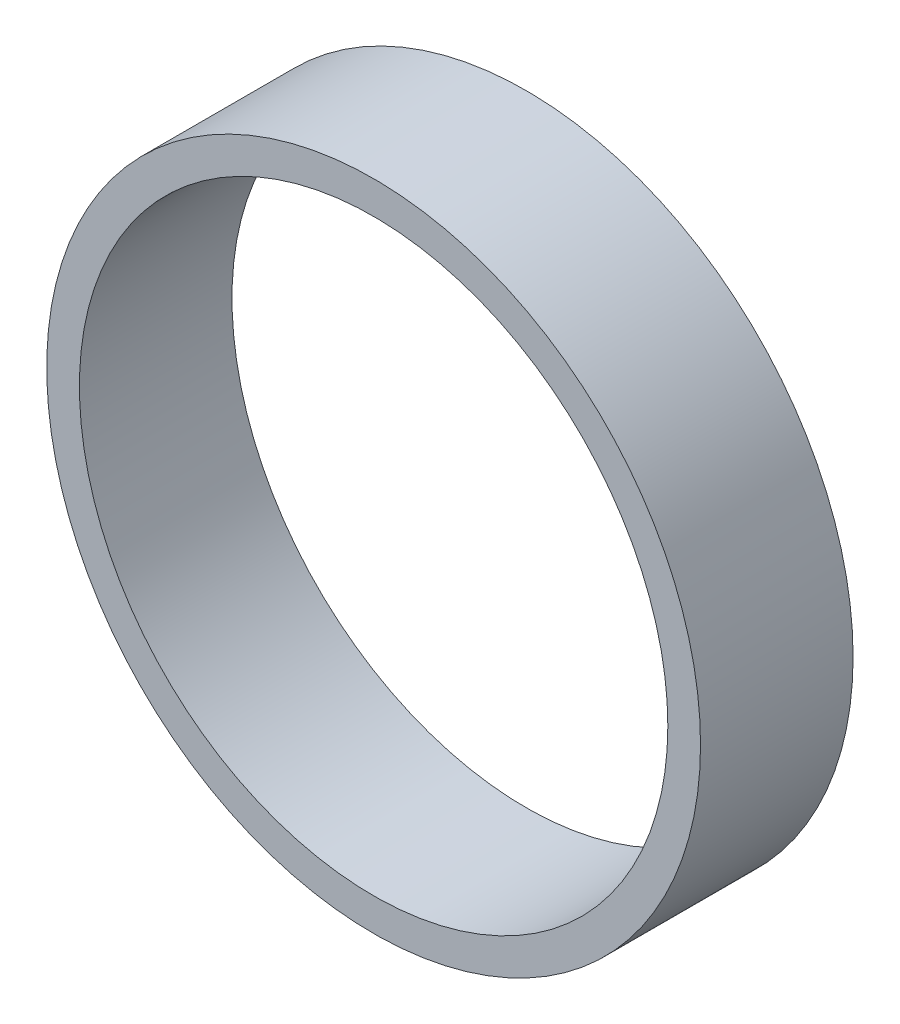
from build123d import *

# Parameters (mm, degrees)
SKETCH1_R           = 15
SKETCH1_R_2         = 13.5
BOSS_EXTRUDE1_DEPTH = 7


with BuildPart() as part:
    # Sketch1 → Boss-Extrude1 (new body)
    with BuildSketch(Plane.XY):
        Circle(SKETCH1_R)
        Circle(SKETCH1_R_2, mode=Mode.SUBTRACT)
    extrude(amount=BOSS_EXTRUDE1_DEPTH)


solid = part.part
